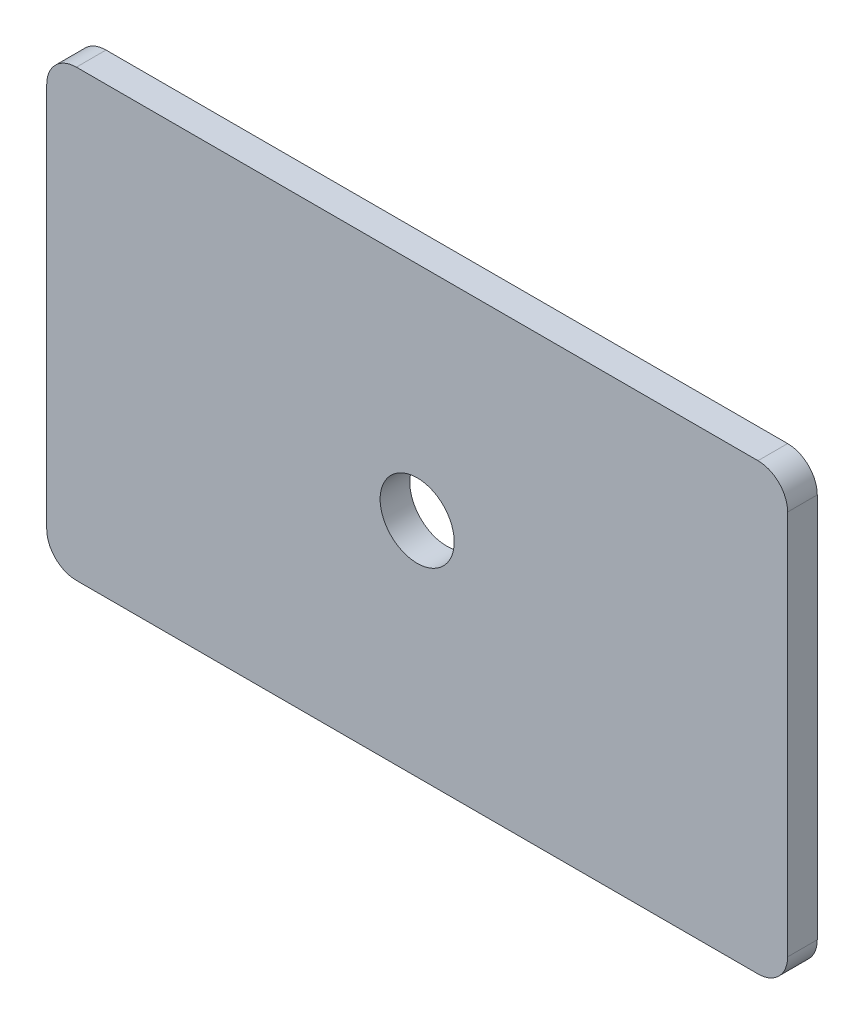
from build123d import *

# Parameters (mm, degrees)
SKIZZE1_W                       = 250
SKIZZE1_H                       = 150
SKIZZE1_R                       = 12.5
AUFSATZ_LINEAR_AUSTRAGEN1_DEPTH = 10
VERRUNDUNG1_R                   = 10


with BuildPart() as part:
    # Skizze1 → Aufsatz-Linear austragen1 (new body)
    with BuildSketch(Plane.XY):
        Rectangle(SKIZZE1_W, SKIZZE1_H)
        Circle(SKIZZE1_R, mode=Mode.SUBTRACT)
    extrude(amount=AUFSATZ_LINEAR_AUSTRAGEN1_DEPTH)

    # Verrundung1
    verrundung1_edges = [part.edges().sort_by_distance(p)[0] for p in [
        (-125, 75, 5),
        (125, 75, 5),
        (125, -75, 5),
        (-125, -75, 5),
    ]]
    fillet(verrundung1_edges, radius=VERRUNDUNG1_R)


solid = part.part
